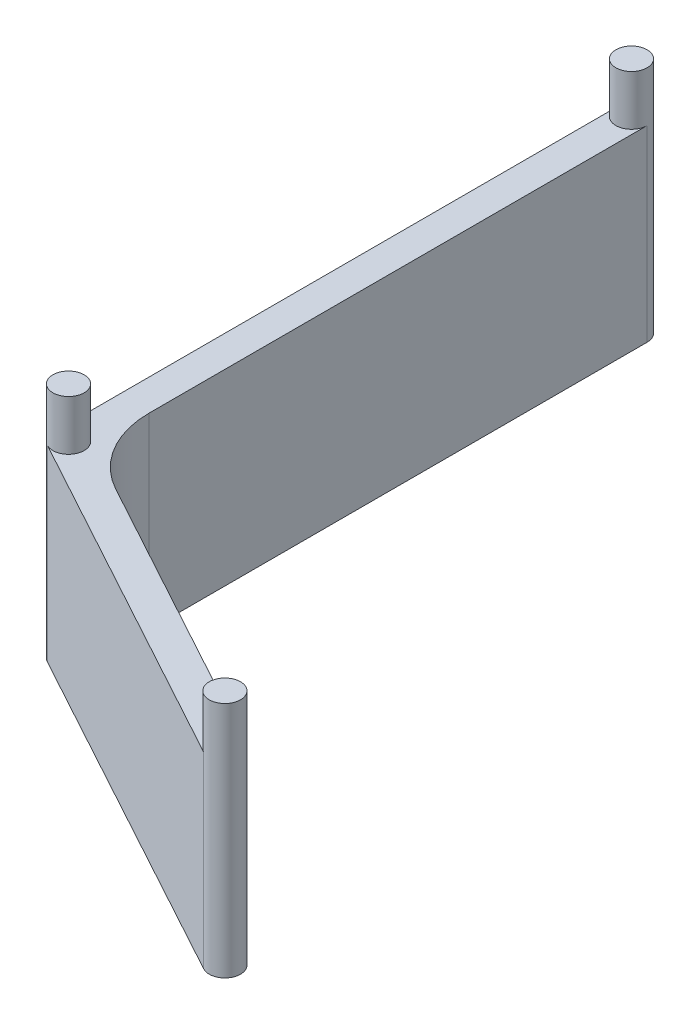
from build123d import *

# Parameters (mm, degrees)
BOSS_EXTRUDE1_DEPTH = 38.1
SKETCH2_R           = 3.175
BOSS_EXTRUDE2_DEPTH = 48.26
FILLET1_R           = 19.05


with BuildPart() as part:
    # Sketch1 → Boss-Extrude1 (new body)
    with BuildSketch(Plane(origin=(0, 0, 0), x_dir=(1, 0, 0), z_dir=(0, 1, 0))):
        with BuildLine():
            Line((-3.175, 0), (-3.175, 114.3))
            ThreePointArc((-3.175, 114.3), (0, 117.475), (3.175, 114.3))
            Line((3.175, 114.3), (3.175, 1.884785088))
            Line((3.175, 1.884785088), (71.370355515, -35.312681556))
            ThreePointArc((71.370355515, -35.312681556), (72.637318444, -39.620355515), (68.329644485, -40.887318444))
            Line((68.329644485, -40.887318444), (-1.520355515, -2.787318444))
            ThreePointArc((-1.520355515, -2.787318444), (-2.73017891, -1.620724566), (-3.175, 0))
        make_face()
    extrude(amount=BOSS_EXTRUDE1_DEPTH)

    # Sketch2 → Boss-Extrude2 (add)
    with BuildSketch(Plane(origin=(0, 0, 0), x_dir=(-1, 0, 0), z_dir=(0, -1, 0))):
        with Locations(Location((0, 114.3, 0), (0, 0, 90))):
            Circle(SKETCH2_R)
        with Locations(Location((0, 0, 0), (0, 0, 90))):
            Circle(SKETCH2_R)
        with Locations(Location((-69.85, -38.1, 0), (0, 0, 90))):
            Circle(SKETCH2_R)
    extrude(amount=-BOSS_EXTRUDE2_DEPTH)

    # Fillet1
    fillet1_edges = [part.edges().sort_by_distance(p)[0] for p in [
        (3.175, 19.05, -1.884785088),
    ]]
    fillet(fillet1_edges, radius=FILLET1_R)


solid = part.part
